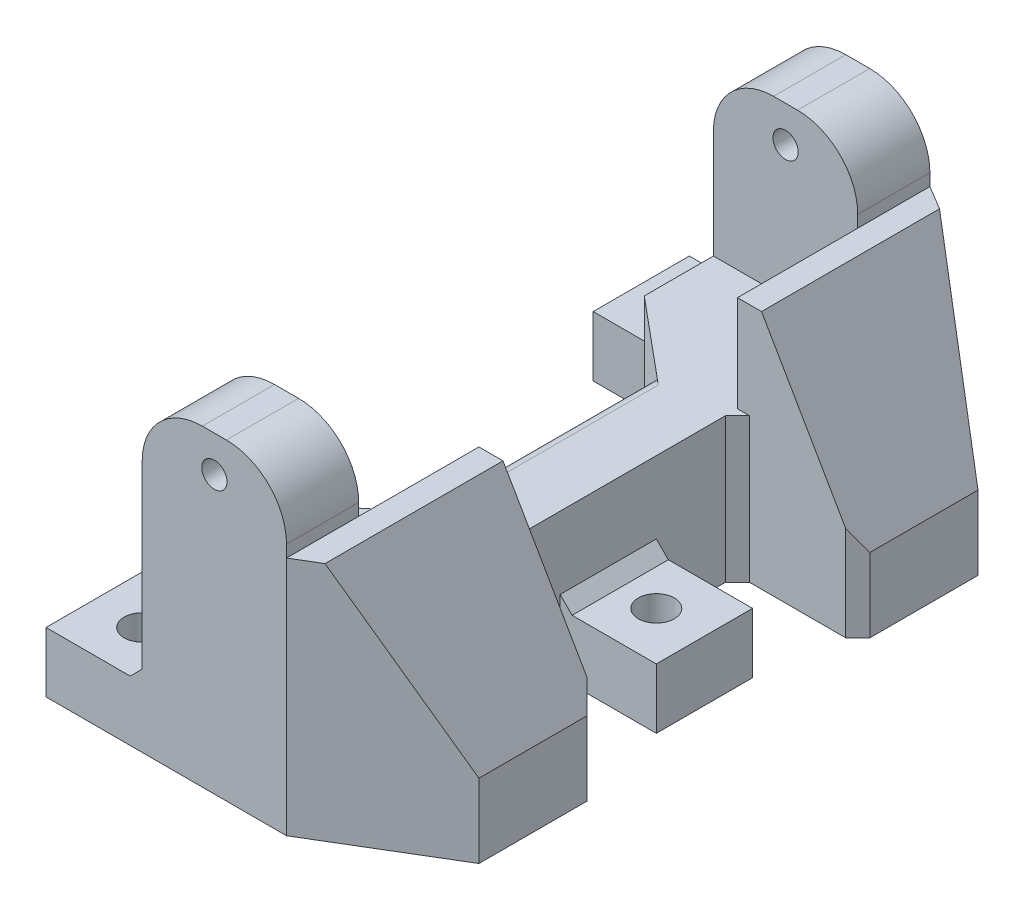
from build123d import *
from OCP.BRepFilletAPI import BRepFilletAPI_MakeChamfer

# Parameters (mm, degrees)
SKETCH_1_W          = 24
SKETCH_1_H          = 107
EXTRUDE_1_DEPTH     = 15
EXTRUDE_2_DEPTH     = 9
SKETCH_3_W          = 20
SKETCH_3_H          = 20
EXTRUDE_4_DEPTH     = 40
SKETCH_4_W          = 24
SKETCH_4_H          = 12
EXTRUDE_6_DEPTH     = 25
CHAMFER_2_SIZE      = 2
SKETCH_5_W          = 16
SKETCH_5_H          = 16
SKETCH_5_R          = 3
EXTRUDE_7_DEPTH     = 10
CHAMFER_3_SIZE      = 2
SKETCH_6_W          = 24
SKETCH_6_H          = 12
SKETCH_6_R          = 2.1
EXTRUDE_8_DEPTH     = 12
EXTRUDE_START       = -12
SKETCH_7_W          = 24
SKETCH_7_H          = 12
SKETCH_7_R          = 2.1
EXTRUDE_9_DEPTH     = 12
FILLET_1_R          = 10
CHAMFER_4_SIZE      = 16
CHAMFER_4_SIZE2     = 27.712812921
CUT_EXTRUDE_1_DEPTH = 12
FILLET_2_R          = 2


with BuildPart() as part:
    # Эскиз1 → Бобышка-Вытянуть1 (new body)
    with BuildSketch(Plane(origin=(0, 0, 0), x_dir=(1, 0, 0), z_dir=(0, 1, 0))):
        with Locations((-12, 0)):
            Rectangle(SKETCH_1_W, SKETCH_1_H)
    extrude(amount=EXTRUDE_1_DEPTH)

    # Эскиз2 → Бобышка-Вытянуть2 (add)
    with BuildSketch(Plane(origin=(0, 15, 0), x_dir=(1, 0, 0), z_dir=(0, 1, 0))):
        Polygon((0, 0), (0, 41.5), (-24, 41.5), (-24, -41.5), (0, -41.5), align=None)
    extrude(amount=EXTRUDE_2_DEPTH)

    # Эскиз3 → Бобышка-Вытянуть4 (add)
    with BuildSketch(Plane(origin=(0, 0, 0), x_dir=(1, 0, 0), z_dir=(0, 1, 0))):
        Polygon((0, 53.5), (20, 41.5), (0, 41.5), align=None)
        with Locations((10, 31.5)):
            Rectangle(SKETCH_3_W, SKETCH_3_H)
        with Locations((10, -31.5)):
            Rectangle(SKETCH_3_W, SKETCH_3_H)
        Polygon((0, -41.5), (0, -53.5), (20, -41.5), align=None)
    extrude(amount=EXTRUDE_4_DEPTH)

    # Эскиз4 → Бобышка-Вытянуть6 (add)
    with BuildSketch(Plane(origin=(0, 15, 0), x_dir=(1, 0, 0), z_dir=(0, 1, 0))):
        with Locations((-12, 47.5)):
            Rectangle(SKETCH_4_W, SKETCH_4_H)
        with Locations((-12, -47.5)):
            Rectangle(SKETCH_4_W, SKETCH_4_H)
    extrude(amount=EXTRUDE_6_DEPTH)

    # Фаска2
    chamfer_2_edges = [part.edges().sort_by_distance(p)[0] for p in [
        (0, 12, -21.5),
        (20, 20, -21.5),
        (0, 12, 21.5),
        (20, 20, 21.5),
    ]]
    chamfer(chamfer_2_edges, length=CHAMFER_2_SIZE)

    # Эскиз5 → Бобышка-Вытянуть7 (add)
    # profile 1 of 3: a face of its own
    with BuildSketch(Plane(origin=(0, 0, 0), x_dir=(1, 0, 0), z_dir=(0, 1, 0))):
        with Locations((-32, 45.5)):
            Rectangle(SKETCH_5_W, SKETCH_5_H)
        with Locations(Location((-32, 45.5, 0), (0, 0, 270))):
            Circle(SKETCH_5_R, mode=Mode.SUBTRACT)
    # profile 2 of 3: a face of its own
    with BuildSketch(Plane(origin=(0, 0, 0), x_dir=(1, 0, 0), z_dir=(0, 1, 0))):
        with Locations((-32, -45.5)):
            Rectangle(SKETCH_5_W, SKETCH_5_H)
        with Locations(Location((-32, -45.5, 0), (0, 0, 270))):
            Circle(SKETCH_5_R, mode=Mode.SUBTRACT)
    # profile 3 of 3: a face of its own
    with BuildSketch(Plane(origin=(0, 0, 0), x_dir=(1, 0, 0), z_dir=(0, 1, 0))):
        with Locations((8, 0)):
            Rectangle(SKETCH_5_W, SKETCH_5_H)
        with Locations(Location((8, 0, 0), (0, 0, 270))):
            Circle(SKETCH_5_R, mode=Mode.SUBTRACT)
    extrude(amount=EXTRUDE_7_DEPTH)

    # Фаска3
    chamfer_3_edges = [part.edges().sort_by_distance(p)[0] for p in [
        (-24, 10, -45.5),
        (-24, 10, 45.5),
        (0, 10, 0),
    ]]
    chamfer(chamfer_3_edges, length=CHAMFER_3_SIZE)

    # Эскиз6 → Бобышка-Вытянуть8 (add)
    with BuildSketch(Plane(origin=(0, 0, -53.5), x_dir=(-1, 0, 0), z_dir=(0, 0, -1))):
        with Locations((12, 46)):
            Rectangle(SKETCH_6_W, SKETCH_6_H)
        with Locations((12, 46)):
            Circle(SKETCH_6_R, mode=Mode.SUBTRACT)
    extrude(amount=-EXTRUDE_8_DEPTH)

    # Эскиз7 → Бобышка-Вытянуть9 (add)
    with BuildSketch(Plane.XY.offset(53.5).offset(EXTRUDE_START)):
        with Locations((-12, 46)):
            Rectangle(SKETCH_7_W, SKETCH_7_H)
        with Locations(Location((-12, 46, 0), (0, 0, 180))):
            Circle(SKETCH_7_R, mode=Mode.SUBTRACT)
    extrude(amount=EXTRUDE_9_DEPTH)

    # Скругление1
    fillet_1_edges = [part.edges().sort_by_distance(p)[0] for p in [
        (0, 52, -47.5),
        (-24, 52, -47.5),
        (-24, 52, 47.5),
        (0, 52, 47.5),
    ]]
    fillet(fillet_1_edges, radius=FILLET_1_R)

    # Фаска4: one chamfer whose edges measure the first distance from different faces: ONE call of the kernel's chamfer builder (chamfer() names one face for all edges)
    chamfer_4_edges_1 = [part.edges().sort_by_distance(p)[0] for p in [
        (20, 40, 32.5),
    ]]
    chamfer_4_side_1 = [part.faces().sort_by_distance(p)[0] for p in [
        (9.191763192, 40, 34.779279279),
    ]]
    chamfer_4_edges_2 = [part.edges().sort_by_distance(p)[0] for p in [
        (20, 40, -32.5),
    ]]
    chamfer_4_side_2 = [part.faces().sort_by_distance(p)[0] for p in [
        (9.191763192, 40, -34.779279279),
    ]]
    chamfer_4 = BRepFilletAPI_MakeChamfer(part.part.solid().wrapped)
    for e in chamfer_4_edges_1:
        chamfer_4.Add(CHAMFER_4_SIZE, CHAMFER_4_SIZE2, e.wrapped, chamfer_4_side_1[0].wrapped)  # the first distance lies on this face
    for e in chamfer_4_edges_2:
        chamfer_4.Add(CHAMFER_4_SIZE, CHAMFER_4_SIZE2, e.wrapped, chamfer_4_side_2[0].wrapped)  # the first distance lies on this face
    add(Compound.cast(chamfer_4.Shape()), mode=Mode.REPLACE)

    # Эскиз8 → Вырез-Вытянуть1 (cut)
    with BuildSketch(Plane(origin=(0, 24, 0), x_dir=(1, 0, 0), z_dir=(0, 1, 0))):
        Polygon((-24, 0), (-24, 30), (-12, 20), (-12, 0), (-12, -20), (-24, -30), align=None)
    extrude(amount=-CUT_EXTRUDE_1_DEPTH, mode=Mode.SUBTRACT)

    # Скругление2
    fillet_2_edges = [part.edges().sort_by_distance(p)[0] for p in [
        (-24, 12, 0),
        (-12, 24, 0),
    ]]
    fillet(fillet_2_edges, radius=FILLET_2_R)


solid = part.part
